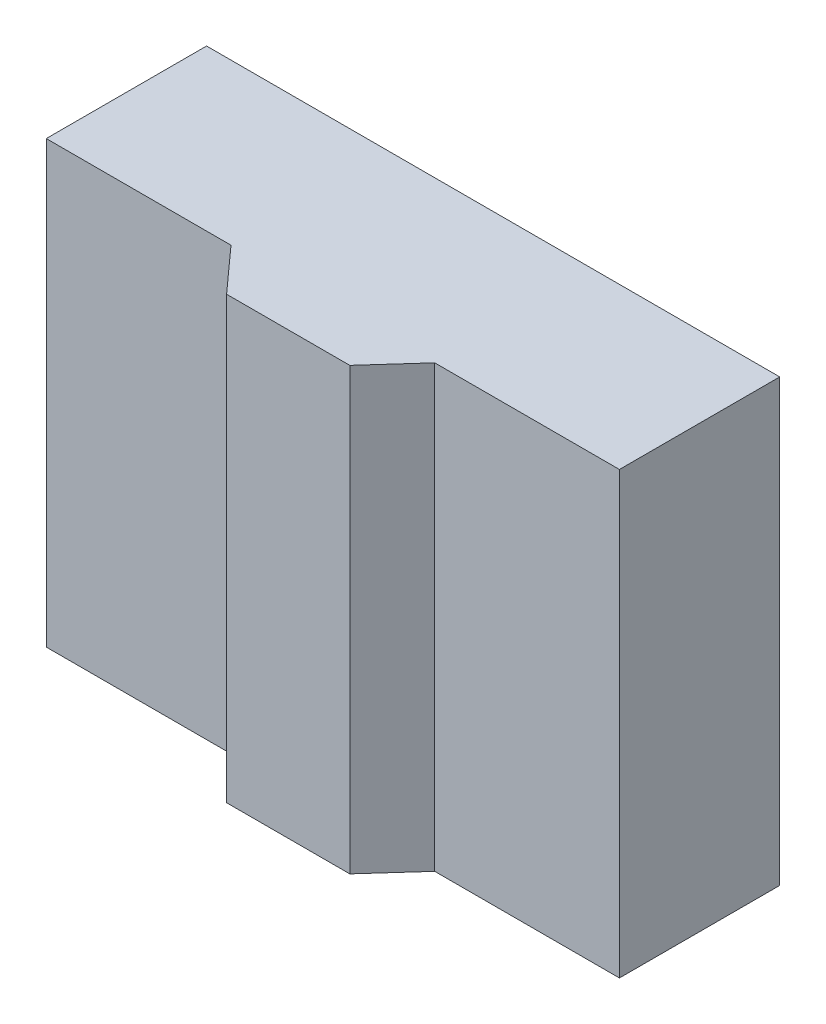
from build123d import *

# Parameters (mm, degrees)
EXTRUDE1_DEPTH = 101.6


with BuildPart() as part:
    # Sketch1 → Extrude1 (new body)
    with BuildSketch(Plane(origin=(0, 0, 0), x_dir=(1, 0, 0), z_dir=(0, 1, 0))):
        Polygon((0, 36.981224411), (0, 0), (42.615353822, 0), (51.897733448, -10.30089681), (80.325021053, -10.30089681), (89.607400679, 0), (132.222754501, 0), (132.222754501, 36.981224411), align=None)
    extrude(amount=-EXTRUDE1_DEPTH)


solid = part.part
